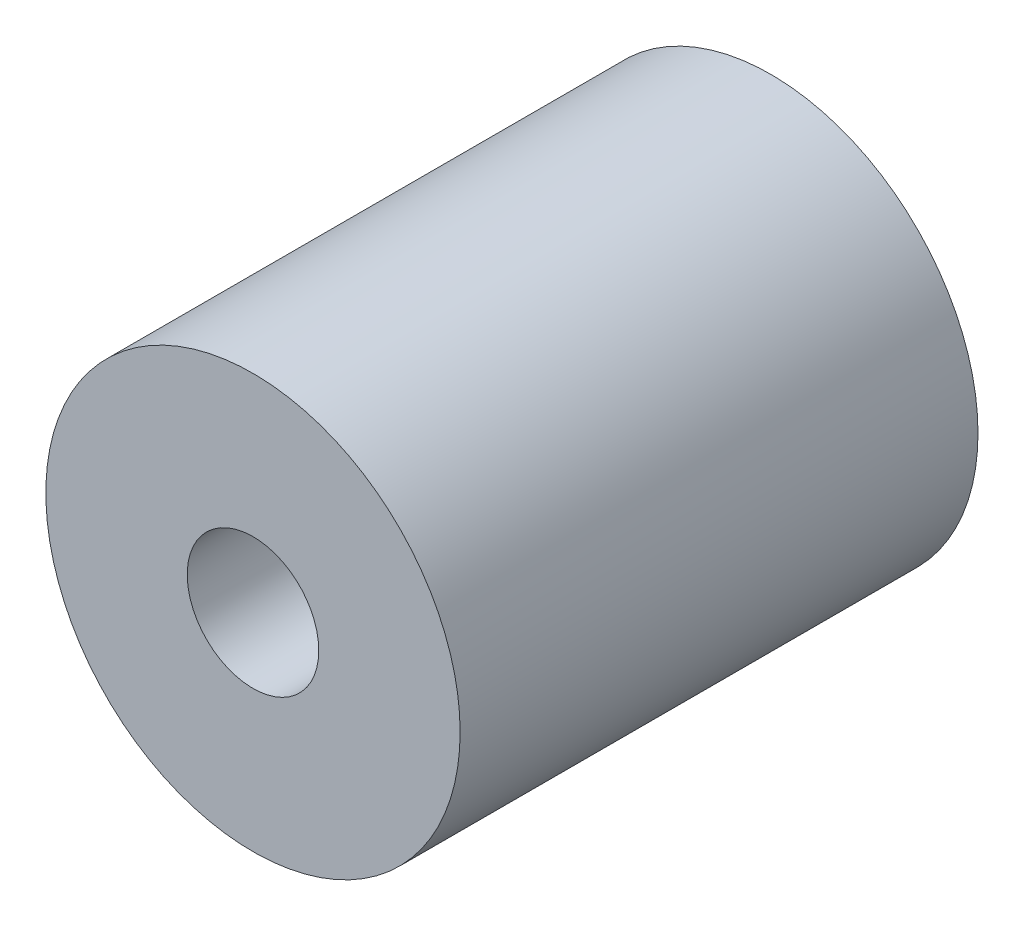
from build123d import *

# Parameters (mm, degrees)
SKETCH1_R        = 10
EXTRUSION1_DEPTH = 25
SKETCH2_R        = 3.175
EXTRUSION2_DEPTH = 12.5
SKETCH3_R        = 5
EXTRUSION3_DEPTH = 12.5


with BuildPart() as part:
    # Sketch1 → Extrusion1 (new body)
    with BuildSketch(Plane.XY):
        Circle(SKETCH1_R)
    extrude(amount=EXTRUSION1_DEPTH)

    # Sketch2 → Extrusion2 (cut)
    with BuildSketch(Plane.XY.offset(25)):
        Circle(SKETCH2_R)
    extrude(amount=-EXTRUSION2_DEPTH, mode=Mode.SUBTRACT)

    # Sketch3 → Extrusion3 (cut)
    with BuildSketch(Plane(origin=(0, 0, 0), x_dir=(-1, 0, 0), z_dir=(0, 0, -1))):
        Circle(SKETCH3_R)
    extrude(amount=-EXTRUSION3_DEPTH, mode=Mode.SUBTRACT)


solid = part.part
